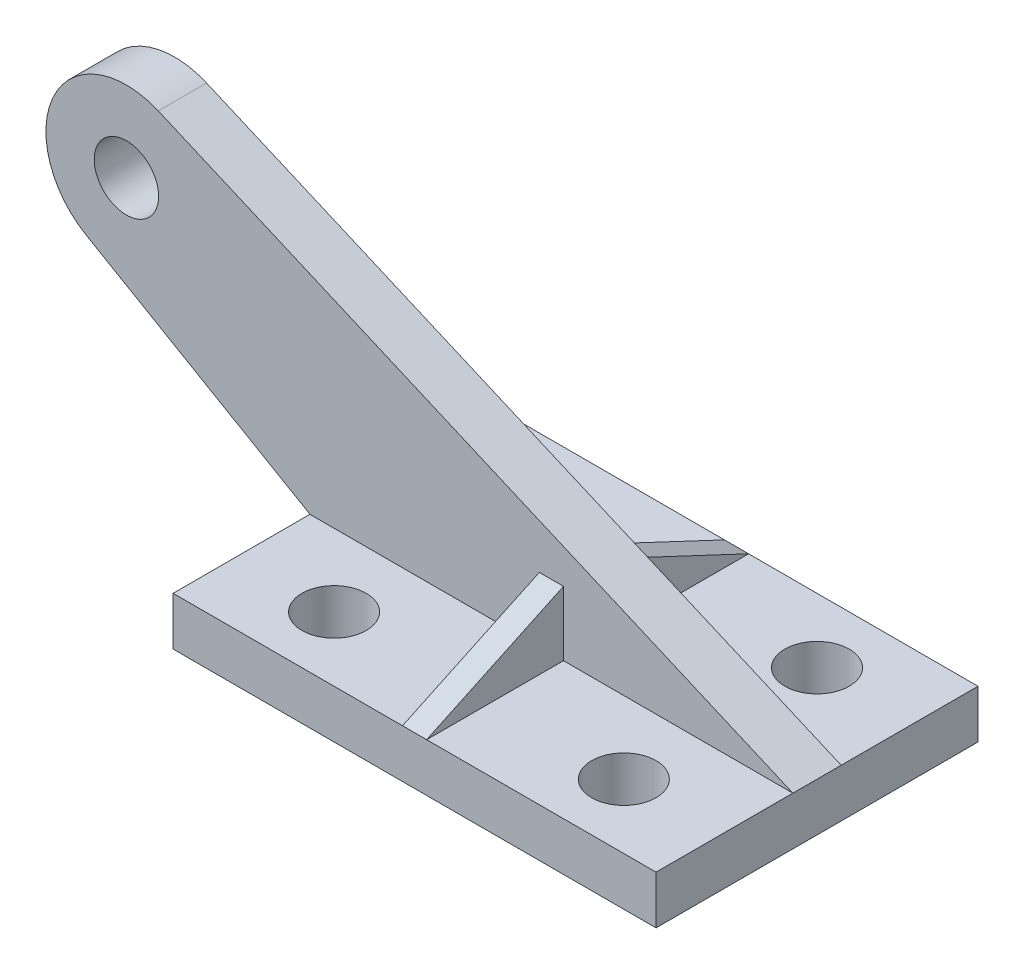
from build123d import *

# Parameters (mm, degrees)
BOSS_EXTRUDE1_DEPTH      = 50
BOSS_EXTRUDE1_DEPTH_BACK = 50
SKETCH1_W                = 150
SKETCH1_H                = 15
BOSS_EXTRUDE2_DEPTH      = 7.5
BOSS_EXTRUDE2_DEPTH_BACK = 7.5
HOLE1_D                  = 20
BOSS_EXTRUDE3_DEPTH      = 3.75
HOLE2_D                  = 20


with BuildPart() as part:
    # Sketch1 → Boss-Extrude1 (new, two sides: drawn at the far end of the back side and taken through both)
    with BuildSketch(Plane.XY.offset(-BOSS_EXTRUDE1_DEPTH_BACK)):
        with Locations((0, 7.5)):
            Rectangle(SKETCH1_W, SKETCH1_H)
    extrude(amount=BOSS_EXTRUDE1_DEPTH + BOSS_EXTRUDE1_DEPTH_BACK)

    # Sketch2 → Boss-Extrude2 (add, two sides: drawn at the far end of the back side and taken through both)
    with BuildSketch(Plane.XY.offset(-BOSS_EXTRUDE2_DEPTH_BACK)):
        with BuildLine():
            Line((75, 15), (-122.10432852, 99.958128973))
            ThreePointArc((-122.10432852, 99.958128973), (-154.328840447, 88.243793145), (-144.552094943, 55.379525617))
            Line((-144.552094943, 55.379525617), (-75, 15))
            Line((-75, 15), (75, 15))
        make_face()
    extrude(amount=BOSS_EXTRUDE2_DEPTH + BOSS_EXTRUDE2_DEPTH_BACK)

    # Hole1 (through all)
    with Locations(Plane.XY.offset(7.5)):
        with Locations((-132, 77)):
            Hole(HOLE1_D / 2)

    # Sketch5 → Boss-Extrude3 (add, symmetric)
    with BuildSketch(Plane(origin=(0, 0, 0), x_dir=(0, 0, -1), z_dir=(1, 0, 0))):
        Polygon((-50, 15), (-7.5, 35), (-7.5, 15), align=None)
    boss_extrude3 = extrude(amount=BOSS_EXTRUDE3_DEPTH, both=True)

    # Mirror1: Boss-Extrude3 across plane
    add(boss_extrude3.mirror(Plane.XY))

    # Hole2 (through all)
    with Locations(Plane(origin=(0, 15, 0), x_dir=(1, 0, 0), z_dir=(0, 1, 0))):
        with Locations((45, -30), (-45, -30)):
            hole2 = Hole(HOLE2_D / 2)

    # Mirror2: Hole2 across plane
    add(hole2.mirror(Plane.XY), mode=Mode.SUBTRACT)


solid = part.part
